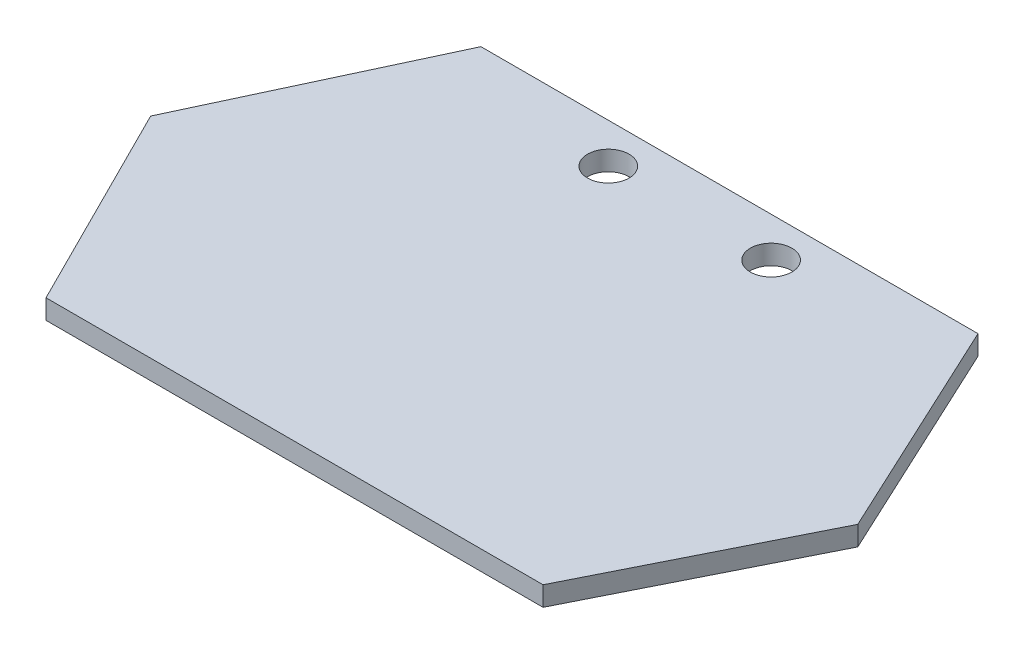
from build123d import *

# Parameters (mm, degrees)
SKETCH1_R           = 1.06045
BOSS_EXTRUDE1_DEPTH = 1


with BuildPart() as part:
    # Sketch1 → Boss-Extrude1 (new body)
    with BuildSketch(Plane(origin=(0, 0, 0), x_dir=(1, 0, 0), z_dir=(0, 1, 0))):
        Polygon((-12.327838828, 14.653846154), (13.072161172, 14.653846154), (18.439413096, 3.143737258), (13.072161172, -7.571153846), (0.372161172, -7.571153846), (-12.327838828, -7.571153846), (-17.695090752, 3.143737258), align=None)
        with Locations(Location((-3.787088828, 12.621846154, 0), (0, 0, 270))):
            Circle(SKETCH1_R, mode=Mode.SUBTRACT)
        with Locations(Location((4.531411172, 12.621846154, 0), (0, 0, 270))):
            Circle(SKETCH1_R, mode=Mode.SUBTRACT)
    extrude(amount=BOSS_EXTRUDE1_DEPTH)


solid = part.part
